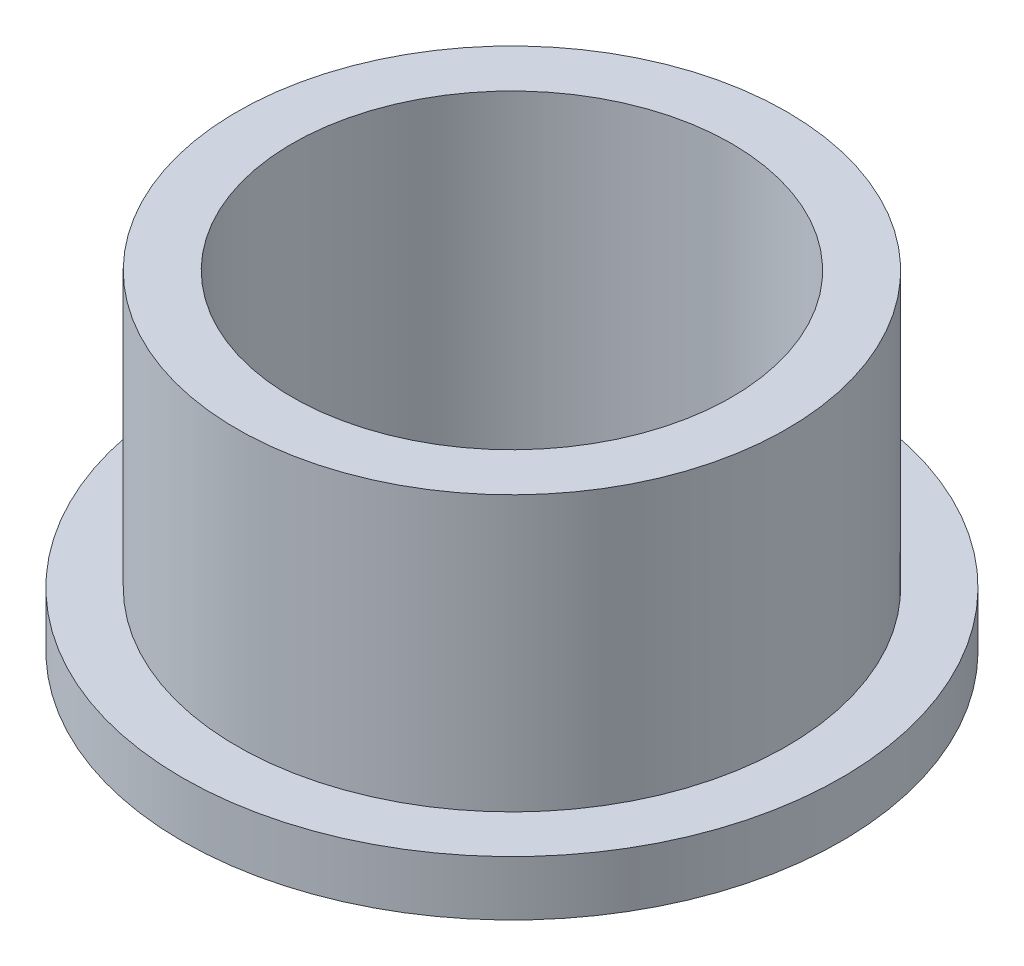
from build123d import *

# Parameters (mm, degrees)
SKETCH2_R           = 15.8877
SKETCH2_R_2         = 12.7
BOSS_EXTRUDE1_DEPTH = 19.05
SKETCH3_R           = 19.05
SKETCH3_R_2         = 15.8877
BOSS_EXTRUDE2_DEPTH = 3.175


with BuildPart() as part:
    # Sketch2 → Boss-Extrude1 (new body)
    with BuildSketch(Plane(origin=(0, 0, 0), x_dir=(1, 0, 0), z_dir=(0, 1, 0))):
        with Locations(Location((0, 0, 0), (0, 0, 90))):
            Circle(SKETCH2_R)
        with Locations(Location((0, 0, 0), (0, 0, 90))):
            Circle(SKETCH2_R_2, mode=Mode.SUBTRACT)
    extrude(amount=BOSS_EXTRUDE1_DEPTH)

    # Sketch3 → Boss-Extrude2 (add)
    with BuildSketch(Plane(origin=(0, 0, 0), x_dir=(1, 0, 0), z_dir=(0, 1, 0))):
        with Locations(Location((0, 0, 0), (0, 0, 270))):
            Circle(SKETCH3_R)
        with Locations(Location((0, 0, 0), (0, 0, 90))):
            Circle(SKETCH3_R_2, mode=Mode.SUBTRACT)
    extrude(amount=BOSS_EXTRUDE2_DEPTH)


solid = part.part
